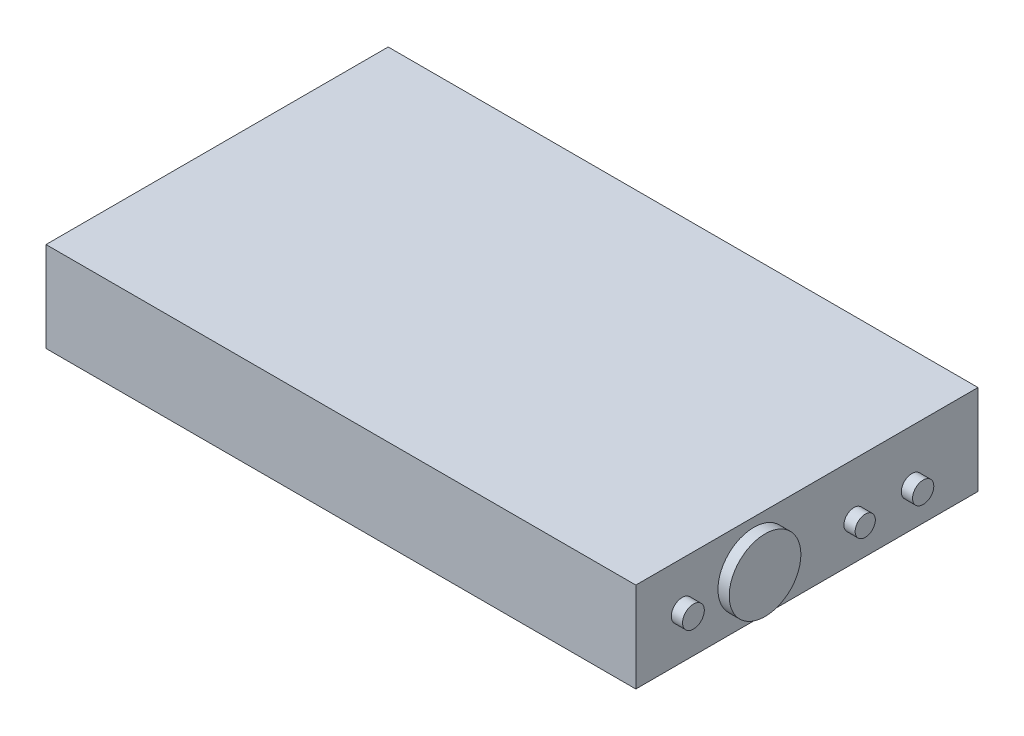
from build123d import *

# Parameters (mm, degrees)
SKETCH1_W           = 332.74
SKETCH1_H           = 193.04
BOSS_EXTRUDE1_DEPTH = 50.8
SKETCH2_R           = 20.216216718
SKETCH2_R_2         = 6.132571036
SKETCH2_R_3         = 5.692545101
SKETCH2_R_4         = 5.992355172
BOSS_EXTRUDE2_DEPTH = 6.35


with BuildPart() as part:
    # Sketch1 → Boss-Extrude1 (new body)
    with BuildSketch(Plane(origin=(0, 0, 0), x_dir=(1, 0, 0), z_dir=(0, 1, 0))):
        with Locations((-166.37, -96.52)):
            Rectangle(SKETCH1_W, SKETCH1_H)
    extrude(amount=BOSS_EXTRUDE1_DEPTH)

    # Sketch2 → Boss-Extrude2 (add)
    with BuildSketch(Plane(origin=(0, 0, 0), x_dir=(0, 0, -1), z_dir=(1, 0, 0))):
        with Locations((-126.480916113, 25.513488319)):
            Circle(SKETCH2_R)
        with Locations(Location((-166.882757539, 25.513488319, 0), (0, 0, 180))):
            Circle(SKETCH2_R_2)
        with Locations(Location((-69.963733445, 21.427908849, 0), (0, 0, 180))):
            Circle(SKETCH2_R_3)
        with Locations(Location((-37.279097685, 21.427908849, 0), (0, 0, 180))):
            Circle(SKETCH2_R_4)
    extrude(amount=BOSS_EXTRUDE2_DEPTH)


solid = part.part
